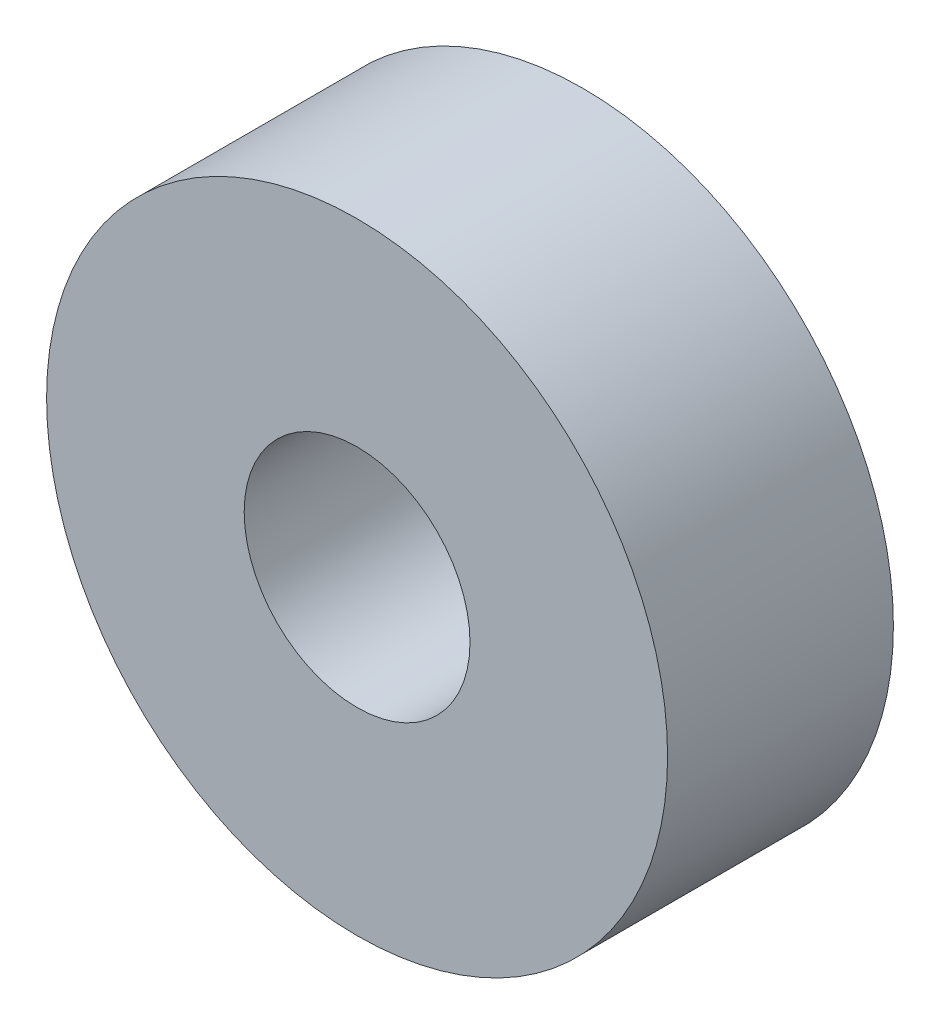
from build123d import *

# Parameters (mm, degrees)
SKETCH_1_R      = 5.5
SKETCH_1_R_2    = 2
EXTRUDE_1_DEPTH = 4


with BuildPart() as part:
    # Эскиз1 → Бобышка-Вытянуть1 (new body)
    with BuildSketch(Plane.XY):
        Circle(SKETCH_1_R)
        Circle(SKETCH_1_R_2, mode=Mode.SUBTRACT)
    extrude(amount=EXTRUDE_1_DEPTH)


solid = part.part
